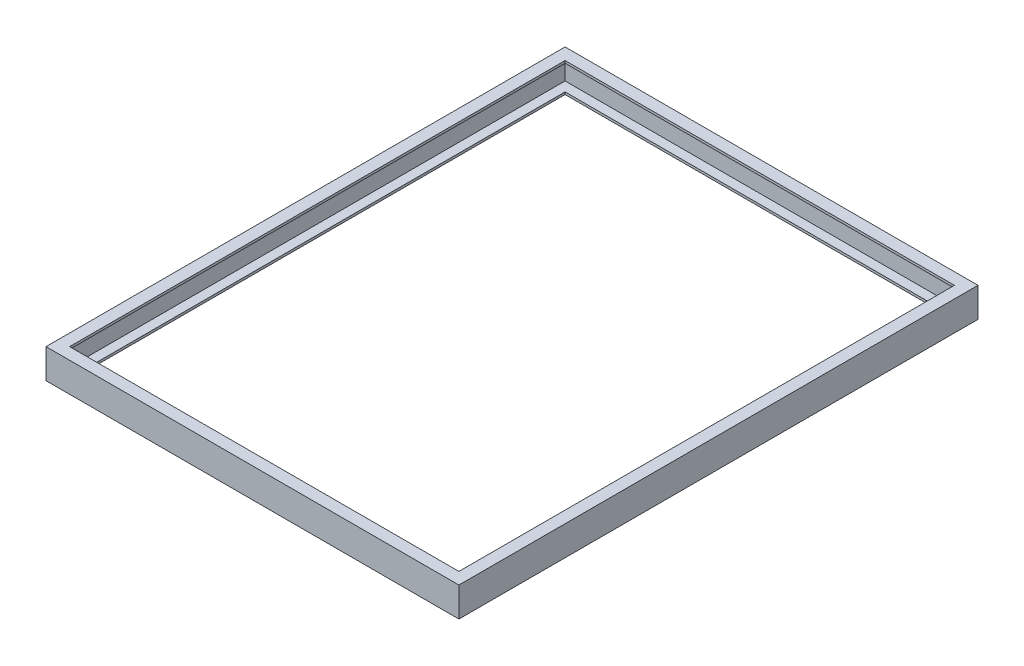
from build123d import *

# Parameters (mm, degrees)
SKETCH1_W           = 350
SKETCH1_H           = 440
SKETCH1_W_2         = 330
SKETCH1_H_2         = 420
BOSS_EXTRUDE1_DEPTH = 25
SHELL1_T            = -2


with BuildPart() as part:
    # Sketch1 → Boss-Extrude1 (new body)
    with BuildSketch(Plane(origin=(0, 0, 0), x_dir=(1, 0, 0), z_dir=(0, 1, 0))):
        with Locations((-175, 220)):
            Rectangle(SKETCH1_W, SKETCH1_H)
        with Locations((-175, 220)):
            Rectangle(SKETCH1_W_2, SKETCH1_H_2, mode=Mode.SUBTRACT)
    extrude(amount=BOSS_EXTRUDE1_DEPTH)

    # Shell1
    shell1_openings = [part.faces().sort_by_distance(p)[0] for p in [
        (-175, 12.5, -10),
        (-10, 12.5, -220),
        (-175, 12.5, -430),
        (-340, 12.5, -220),
    ]]
    offset(amount=SHELL1_T, openings=shell1_openings, kind=Kind.INTERSECTION)


solid = part.part
